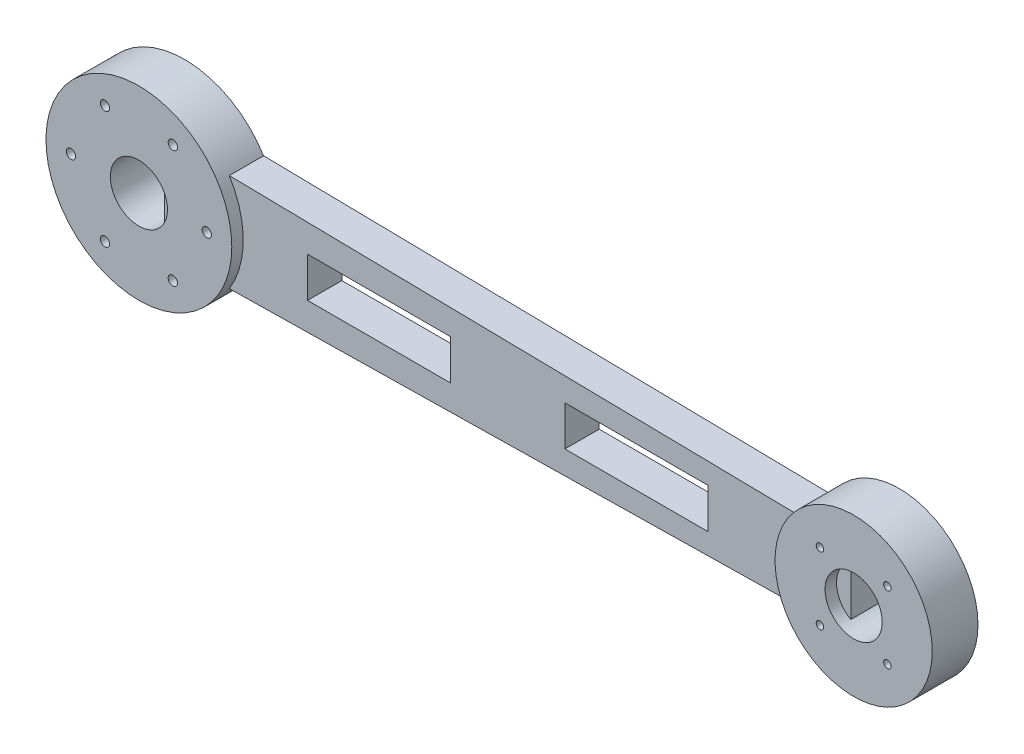
from build123d import *

# Parameters (mm, degrees)
SKETCH1_R           = 65
SKETCH1_R_2         = 20
SKETCH1_R_3         = 3.25
BOSS_EXTRUDE1_DEPTH = 32
SKETCH2_R           = 55
SKETCH2_R_2         = 20
SKETCH2_R_3         = 2.6
BOSS_EXTRUDE2_DEPTH = 32
SKETCH3_W           = 100
SKETCH3_H           = 28
BOSS_EXTRUDE3_DEPTH = 24


with BuildPart() as part:
    # Sketch1 → Boss-Extrude1 (new body)
    with BuildSketch(Plane.XY):
        Circle(SKETCH1_R)
        Circle(SKETCH1_R_2, mode=Mode.SUBTRACT)
        with Locations((47.5, 0)):
            Circle(SKETCH1_R_3, mode=Mode.SUBTRACT)
        with Locations((23.75, 41.13620668)):
            Circle(SKETCH1_R_3, mode=Mode.SUBTRACT)
        with Locations((-23.75, 41.13620668)):
            Circle(SKETCH1_R_3, mode=Mode.SUBTRACT)
        with Locations((-47.5, 0)):
            Circle(SKETCH1_R_3, mode=Mode.SUBTRACT)
        with Locations((-23.75, -41.13620668)):
            Circle(SKETCH1_R_3, mode=Mode.SUBTRACT)
        with Locations((23.75, -41.13620668)):
            Circle(SKETCH1_R_3, mode=Mode.SUBTRACT)
    extrude(amount=BOSS_EXTRUDE1_DEPTH)



with BuildPart() as body_2:
    # Sketch2 → Boss-Extrude2 (new body)
    with BuildSketch(Plane.XY):
        with Locations((500, 0)):
            Circle(SKETCH2_R)
        with Locations((500, 0)):
            Circle(SKETCH2_R_2, mode=Mode.SUBTRACT)
        with Locations((476.43, -23.57)):
            Circle(SKETCH2_R_3, mode=Mode.SUBTRACT)
        with Locations((476.43, 23.57)):
            Circle(SKETCH2_R_3, mode=Mode.SUBTRACT)
        with Locations((523.57, -23.57)):
            Circle(SKETCH2_R_3, mode=Mode.SUBTRACT)
        with Locations((523.57, 23.57)):
            Circle(SKETCH2_R_3, mode=Mode.SUBTRACT)
    extrude(amount=BOSS_EXTRUDE2_DEPTH)


with BuildPart() as part_1:
    add(part.part)

    add(body_2.part)  # Boss-Extrude3 merges body 2
    # Sketch3 → Boss-Extrude3 (add)
    with BuildSketch(Plane.XY):
        Polygon((10, -35), (10, 35), (490, 27), (490, -27), align=None)
        with Locations((160, 0)):
            Rectangle(SKETCH3_W, SKETCH3_H, mode=Mode.SUBTRACT)
        with Locations((340, 0)):
            Rectangle(SKETCH3_W, SKETCH3_H, mode=Mode.SUBTRACT)
    extrude(amount=BOSS_EXTRUDE3_DEPTH)


solid = part_1.part
